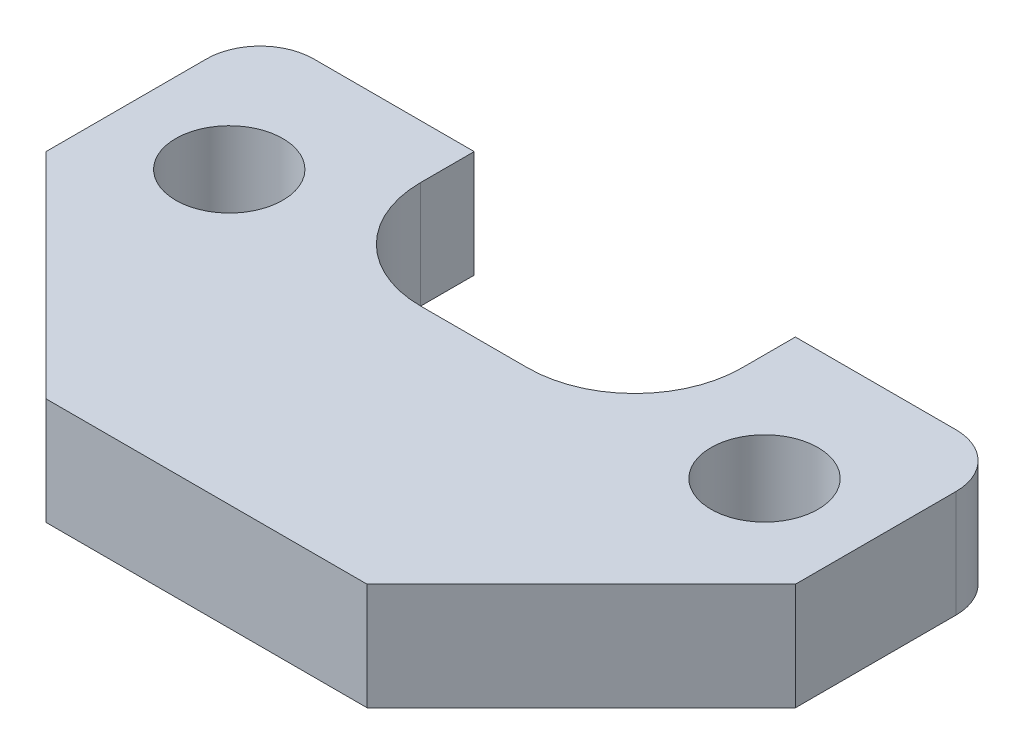
from build123d import *

# Parameters (mm, degrees)
BOSS_EXTRUDE2_DEPTH      = 5
BOSS_EXTRUDE2_DEPTH_BACK = 5
SKETCH1_R                = 5


with BuildPart() as part:
    # Sketch1 → Boss-Extrude2 (new, two sides: drawn at the far end of the back side and taken through both)
    with BuildSketch(Plane(origin=(0, 0, 0), x_dir=(1, 0, 0), z_dir=(0, 1, 0)).offset(-BOSS_EXTRUDE2_DEPTH_BACK)):
        with BuildLine():
            Line((-30, 12.882308015), (-15, 12.882308015))
            Line((-15, 12.882308015), (-15, 7.882308015))
            ThreePointArc((-15, 7.882308015), (-12.071067812, 0.811240203), (-5, -2.117691985))
            Line((-5, -2.117691985), (5, -2.117691985))
            ThreePointArc((5, -2.117691985), (12.071067812, 0.811240203), (15, 7.882308015))
            Line((15, 7.882308015), (15, 12.882308015))
            Line((15, 12.882308015), (30, 12.882308015))
            ThreePointArc((30, 12.882308015), (33.535533906, 11.417841921), (35, 7.882308015))
            Line((35, 7.882308015), (35, -7.117691985))
            Line((35, -7.117691985), (15, -27.117691985))
            Line((15, -27.117691985), (-15, -27.117691985))
            Line((-15, -27.117691985), (-35, -7.117691985))
            Line((-35, -7.117691985), (-35, 7.882308015))
            ThreePointArc((-35, 7.882308015), (-33.535533906, 11.417841921), (-30, 12.882308015))
        make_face()
        with Locations((-25, 0)):
            Circle(SKETCH1_R, mode=Mode.SUBTRACT)
        with Locations((25, 0)):
            Circle(SKETCH1_R, mode=Mode.SUBTRACT)
    extrude(amount=BOSS_EXTRUDE2_DEPTH + BOSS_EXTRUDE2_DEPTH_BACK)


solid = part.part
